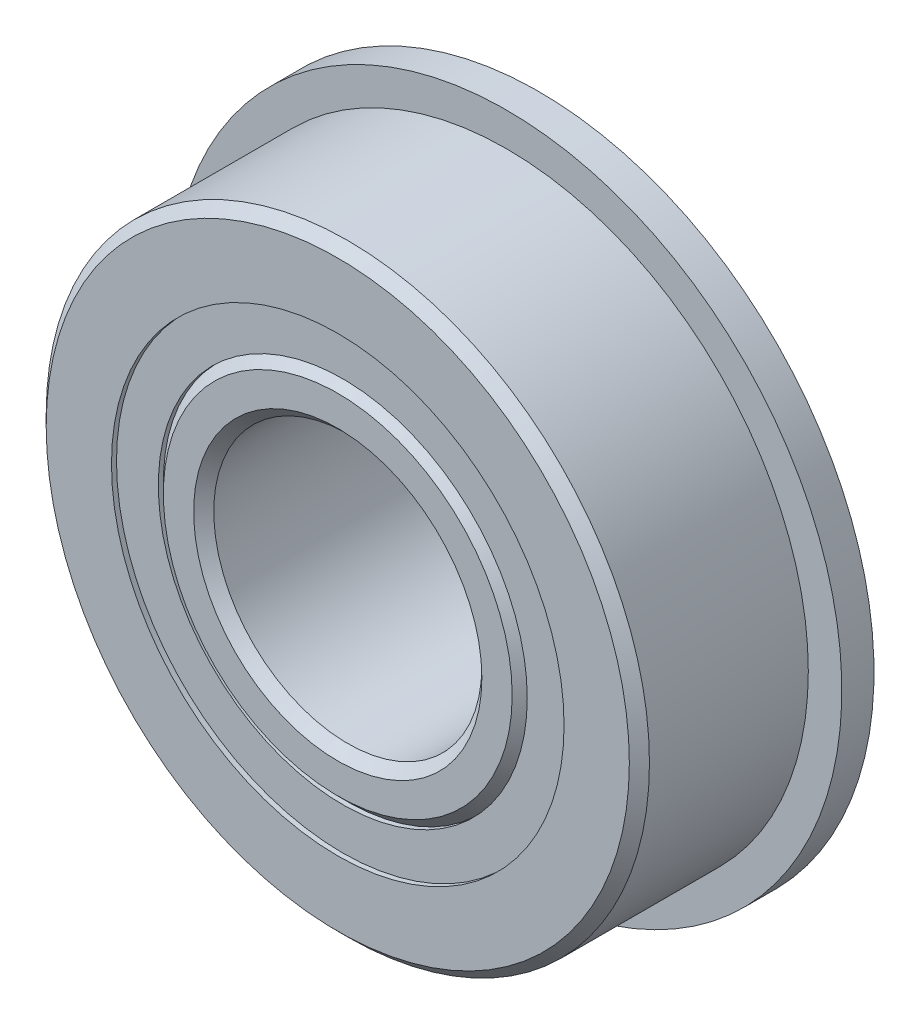
from build123d import *

# Parameters (mm, degrees)
SKETCH6_W         = 1.524
SKETCH6_H         = 5.1562
CIRPATTERN1_COUNT = 12
SKETCH5_W         = 2.743836812
SKETCH5_H         = 1.9812


with BuildPart() as part:
    # Sketch1 → Revolve1 (revolve)
    with BuildSketch(Plane(origin=(0, 0, 0), x_dir=(0, 0, -1), z_dir=(1, 0, 0)), mode=Mode.PRIVATE) as revolve1_sk:
        with BuildLine():
            Line((4.28625, 14.2875), (-4.28625, 14.2875))
            Line((-4.28625, 14.2875), (-4.7625, 13.81125))
            Line((-4.7625, 13.81125), (-4.7625, 10.7188))
            Line((-4.7625, 10.7188), (-2.347405282, 10.7188))
            ThreePointArc((-2.347405282, 10.7188), (0, 12.7), (2.347405282, 10.7188))
            Line((2.347405282, 10.7188), (4.7625, 10.7188))
            Line((4.7625, 10.7188), (4.7625, 13.81125))
            Line((4.7625, 13.81125), (4.28625, 14.2875))
        make_face()
    revolve(revolve1_sk.sketch.rotate(Axis((0, 0, 4.7625), (0, 0, -1)), 90), axis=Axis((0, 0, 4.7625), (0, 0, -1)))

    # Sketch6 → Revolve6 (revolve)
    with BuildSketch(Plane(origin=(0, 0, 0), x_dir=(0, 0, -1), z_dir=(1, 0, 0)), mode=Mode.PRIVATE) as revolve6_sk:
        with Locations((4.0005, 13.2969)):
            Rectangle(SKETCH6_W, SKETCH6_H)
    revolve(revolve6_sk.sketch.rotate(Axis((0, 0, -4.7625), (0, 0, 1)), 270), axis=Axis((0, 0, -4.7625), (0, 0, 1)))


with BuildPart() as body_2:
    # Sketch3 → Revolve3 (revolve)
    with BuildSketch(Plane(origin=(0, 0, 0), x_dir=(0, 0, -1), z_dir=(1, 0, 0)), mode=Mode.PRIVATE) as revolve3_sk:
        with BuildLine():
            Line((-4.7625, 6.82625), (-4.7625, 8.26135))
            Line((-4.7625, 8.26135), (-4.28625, 8.7376))
            Line((-4.28625, 8.7376), (-1.780538188, 8.7376))
            ThreePointArc((-1.780538188, 8.7376), (0, 7.9375), (1.780538188, 8.7376))
            Line((1.780538188, 8.7376), (5.88645, 8.7376))
            Line((5.88645, 8.7376), (6.3627, 8.26135))
            Line((6.3627, 8.26135), (6.3627, 6.82625))
            Line((6.3627, 6.82625), (5.88645, 6.35))
            Line((5.88645, 6.35), (-4.28625, 6.35))
            Line((-4.28625, 6.35), (-4.7625, 6.82625))
        make_face()
    revolve(revolve3_sk.sketch.rotate(Axis((0, 0, 4.7625), (0, 0, -1)), 90), axis=Axis((0, 0, 4.7625), (0, 0, -1)))


with BuildPart() as body_3:
    # Sketch4 → Revolve4 (revolve)
    with BuildSketch(Plane(origin=(0, 0, 0), x_dir=(0, 0, -1), z_dir=(1, 0, 0))):
        with BuildLine():
            Line((-2.38125, 10.31875), (2.38125, 10.31875))
            ThreePointArc((2.38125, 10.31875), (0, 12.7), (-2.38125, 10.31875))
        make_face()
    revolve(axis=Axis((0, 10.31875, 2.38125), (0, 0, -1)))


with BuildPart() as cirpattern1_1:
    # CirPattern1: pattern copy
    add(body_3.part.rotate(Axis((0, 0, 0), (0, 0, 1)), 1 * 360 / CIRPATTERN1_COUNT))


with BuildPart() as cirpattern1_2:
    # CirPattern1: pattern copy
    add(body_3.part.rotate(Axis((0, 0, 0), (0, 0, 1)), 2 * 360 / CIRPATTERN1_COUNT))


with BuildPart() as cirpattern1_3:
    # CirPattern1: pattern copy
    add(body_3.part.rotate(Axis((0, 0, 0), (0, 0, 1)), 3 * 360 / CIRPATTERN1_COUNT))


with BuildPart() as cirpattern1_4:
    # CirPattern1: pattern copy
    add(body_3.part.rotate(Axis((0, 0, 0), (0, 0, 1)), 4 * 360 / CIRPATTERN1_COUNT))


with BuildPart() as cirpattern1_5:
    # CirPattern1: pattern copy
    add(body_3.part.rotate(Axis((0, 0, 0), (0, 0, 1)), 5 * 360 / CIRPATTERN1_COUNT))


with BuildPart() as cirpattern1_6:
    # CirPattern1: pattern copy
    add(body_3.part.rotate(Axis((0, 0, 0), (0, 0, 1)), 6 * 360 / CIRPATTERN1_COUNT))


with BuildPart() as cirpattern1_7:
    # CirPattern1: pattern copy
    add(body_3.part.rotate(Axis((0, 0, 0), (0, 0, 1)), 7 * 360 / CIRPATTERN1_COUNT))


with BuildPart() as cirpattern1_8:
    # CirPattern1: pattern copy
    add(body_3.part.rotate(Axis((0, 0, 0), (0, 0, 1)), 8 * 360 / CIRPATTERN1_COUNT))


with BuildPart() as cirpattern1_9:
    # CirPattern1: pattern copy
    add(body_3.part.rotate(Axis((0, 0, 0), (0, 0, 1)), 9 * 360 / CIRPATTERN1_COUNT))


with BuildPart() as cirpattern1_10:
    # CirPattern1: pattern copy
    add(body_3.part.rotate(Axis((0, 0, 0), (0, 0, 1)), 10 * 360 / CIRPATTERN1_COUNT))


with BuildPart() as cirpattern1_11:
    # CirPattern1: pattern copy
    add(body_3.part.rotate(Axis((0, 0, 0), (0, 0, 1)), 11 * 360 / CIRPATTERN1_COUNT))


with BuildPart() as body_15:
    # Sketch5 → Revolve5 (revolve)
    with BuildSketch(Plane(origin=(0, 0, 0), x_dir=(0, 0, -1), z_dir=(1, 0, 0)), mode=Mode.PRIVATE) as revolve5_sk:
        with Locations((-3.152456594, 9.7282)):
            Rectangle(SKETCH5_W, SKETCH5_H)
        with Locations((3.152456594, 9.7282)):
            Rectangle(SKETCH5_W, SKETCH5_H)
    revolve(revolve5_sk.sketch.rotate(Axis((0, 0, 4.7625), (0, 0, -1)), 90), axis=Axis((0, 0, 4.7625), (0, 0, -1)))


solid = Compound([part.part, body_2.part, body_3.part, cirpattern1_1.part, cirpattern1_2.part, cirpattern1_3.part, cirpattern1_4.part, cirpattern1_5.part, cirpattern1_6.part, cirpattern1_7.part, cirpattern1_8.part, cirpattern1_9.part, cirpattern1_10.part, cirpattern1_11.part, body_15.part])
